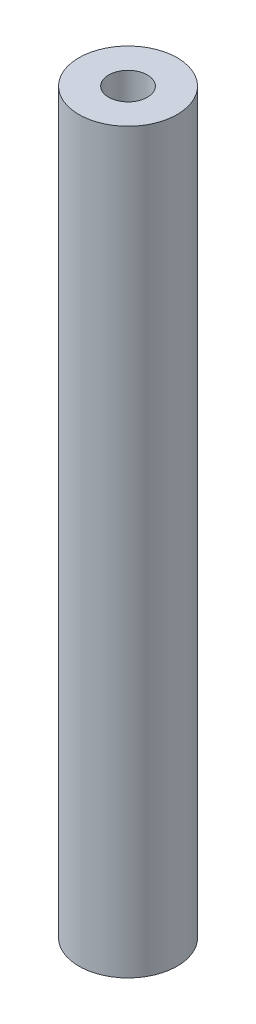
from build123d import *

# Parameters (mm, degrees)
SKETCH1_R           = 2.54
SKETCH1_R_2         = 1.00000054
BOSS_EXTRUDE1_DEPTH = 38.1


with BuildPart() as part:
    # Sketch1 → Boss-Extrude1 (new body)
    with BuildSketch(Plane(origin=(0, 0, 0), x_dir=(1, 0, 0), z_dir=(0, 1, 0))):
        with Locations(Location((0, 0, 0), (0, 0, 90))):
            Circle(SKETCH1_R)
        with Locations(Location((0, 0, 0), (0, 0, 90))):
            Circle(SKETCH1_R_2, mode=Mode.SUBTRACT)
    extrude(amount=BOSS_EXTRUDE1_DEPTH)


solid = part.part
